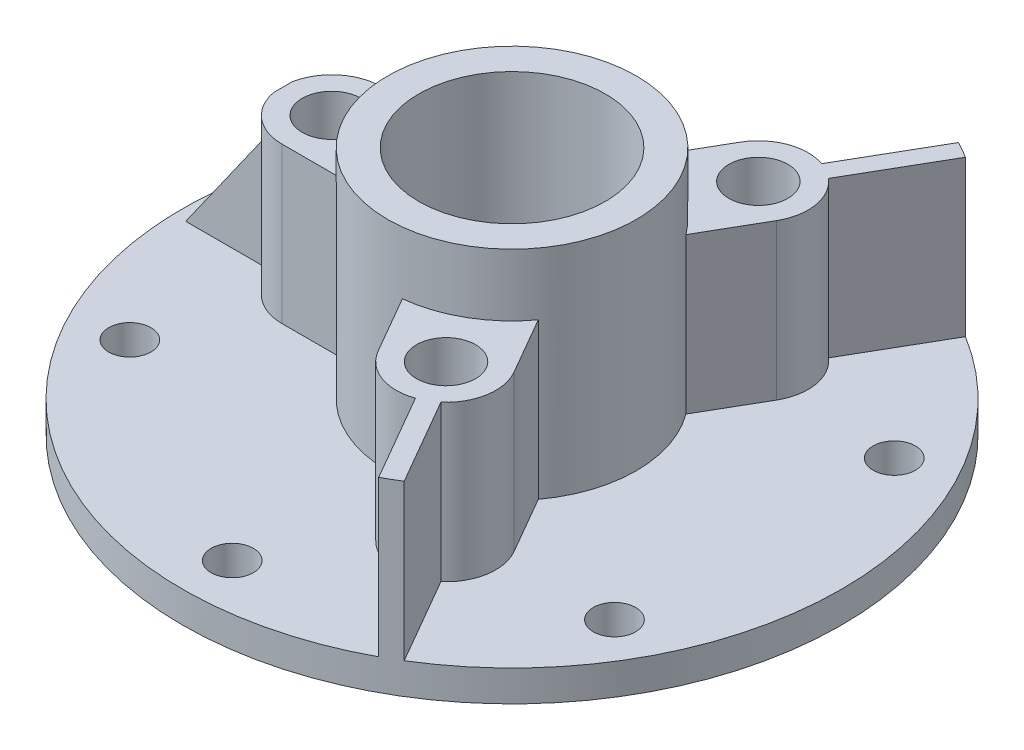
from build123d import *
from build123d.topology import SkipClean

# Parameters (mm, degrees)
SKETCH1_R           = 53
BOSS_EXTRUDE1_DEPTH = 5
SKETCH2_R           = 20
BOSS_EXTRUDE2_DEPTH = 35
SKETCH3_R           = 15
CUT_EXTRUDE1_DEPTH  = 85.958813551
BOSS_EXTRUDE3_START = -25
SKETCH4_R           = 4.75
BOSS_EXTRUDE3_DEPTH = 25
CUT_EXTRUDE2_DEPTH  = 86.902561079
CIRPATTERN1_COUNT   = 3
SKETCH6_R           = 3.4
CUT_EXTRUDE3_DEPTH  = 83.722427431


with BuildPart() as part:
    # Sketch1 → Boss-Extrude1 (new body)
    with BuildSketch(Plane(origin=(0, 0, 0), x_dir=(1, 0, 0), z_dir=(0, 1, 0))):
        with Locations(Location((0, 0, 0), (0, 0, 270))):
            Circle(SKETCH1_R)
    extrude(amount=BOSS_EXTRUDE1_DEPTH)

    # Sketch2 → Boss-Extrude2 (add)
    with BuildSketch(Plane(origin=(0, 5, 0), x_dir=(1, 0, 0), z_dir=(0, 1, 0))):
        with Locations(Location((0, 0, 0), (0, 0, 270))):
            Circle(SKETCH2_R)
    extrude(amount=BOSS_EXTRUDE2_DEPTH)

    # Sketch3 → Cut-Extrude1 (cut, through all)
    with BuildSketch(Plane(origin=(0, 40, 0), x_dir=(1, 0, 0), z_dir=(0, 1, 0))):
        with Locations(Location((0, 0, 0), (0, 0, 270))):
            Circle(SKETCH3_R)
    extrude(amount=-CUT_EXTRUDE1_DEPTH, mode=Mode.SUBTRACT)

    # Sketch4 → Boss-Extrude3 (add)
    with BuildSketch(Plane(origin=(0, 30, 0), x_dir=(1, 0, 0), z_dir=(0, 1, 0)).offset(BOSS_EXTRUDE3_START)):
        with BuildLine():
            Line((-29, 8), (-18.33030278, 8))
            ThreePointArc((-18.33030278, 8), (-20, 0), (-18.33030278, -8))
            Line((-18.33030278, -8), (-29, -8))
            ThreePointArc((-29, -8), (-34.099019514, -6.164414003), (-36.858116823, -1.5))
            Line((-36.858116823, -1.5), (-52.978769333, -1.5))
            ThreePointArc((-52.978769333, -1.5), (-53, 0), (-52.978769333, 1.5))
            Line((-52.978769333, 1.5), (-36.858116823, 1.5))
            ThreePointArc((-36.858116823, 1.5), (-34.099019514, 6.164414003), (-29, 8))
        make_face()
        with Locations(Location((-29, 0, 0), (0, 0, 270))):
            Circle(SKETCH4_R, mode=Mode.SUBTRACT)
    boss_extrude3 = extrude(amount=BOSS_EXTRUDE3_DEPTH)

    # Sketch5 → Cut-Extrude2 (cut, through all)
    with BuildSketch(Plane.XY.offset(1.5)):
        Polygon((-36.858116823, 25), (-50.978769333, 5), (-53.978769333, 5), (-53.978769333, 30), (-36.858116823, 30), align=None)
    extrude(amount=-CUT_EXTRUDE2_DEPTH, mode=Mode.SUBTRACT)

    # CirPattern1: Boss-Extrude3 ×3 about axis
    with SkipClean():  # the faces are left unmerged after this step: merging them gives an invalid solid
        cirpattern1_axis = Axis((0, 0, 0), (0, 1, 0))
        for i in range(1, CIRPATTERN1_COUNT):
            add(boss_extrude3.rotate(cirpattern1_axis, i * 360 / CIRPATTERN1_COUNT))

    # Sketch6 → Cut-Extrude3 (cut, through all)
    with SkipClean():  # the faces are left unmerged after this step: merging them gives an invalid solid
        with BuildSketch(Plane(origin=(0, 5, 0), x_dir=(1, 0, 0), z_dir=(0, 1, 0))):
            with Locations(Location((0, 45, 0), (0, 0, 270))):
                Circle(SKETCH6_R)
            with Locations(Location((38.97114317, 22.5, 0), (0, 0, 270))):
                Circle(SKETCH6_R)
            with Locations(Location((38.97114317, -22.5, 0), (0, 0, 270))):
                Circle(SKETCH6_R)
            with Locations(Location((0, -45, 0), (0, 0, 270))):
                Circle(SKETCH6_R)
            with Locations(Location((-38.97114317, -22.5, 0), (0, 0, 270))):
                Circle(SKETCH6_R)
            with Locations(Location((-38.97114317, 22.5, 0), (0, 0, 270))):
                Circle(SKETCH6_R)
        extrude(amount=-CUT_EXTRUDE3_DEPTH, mode=Mode.SUBTRACT)


solid = part.part
